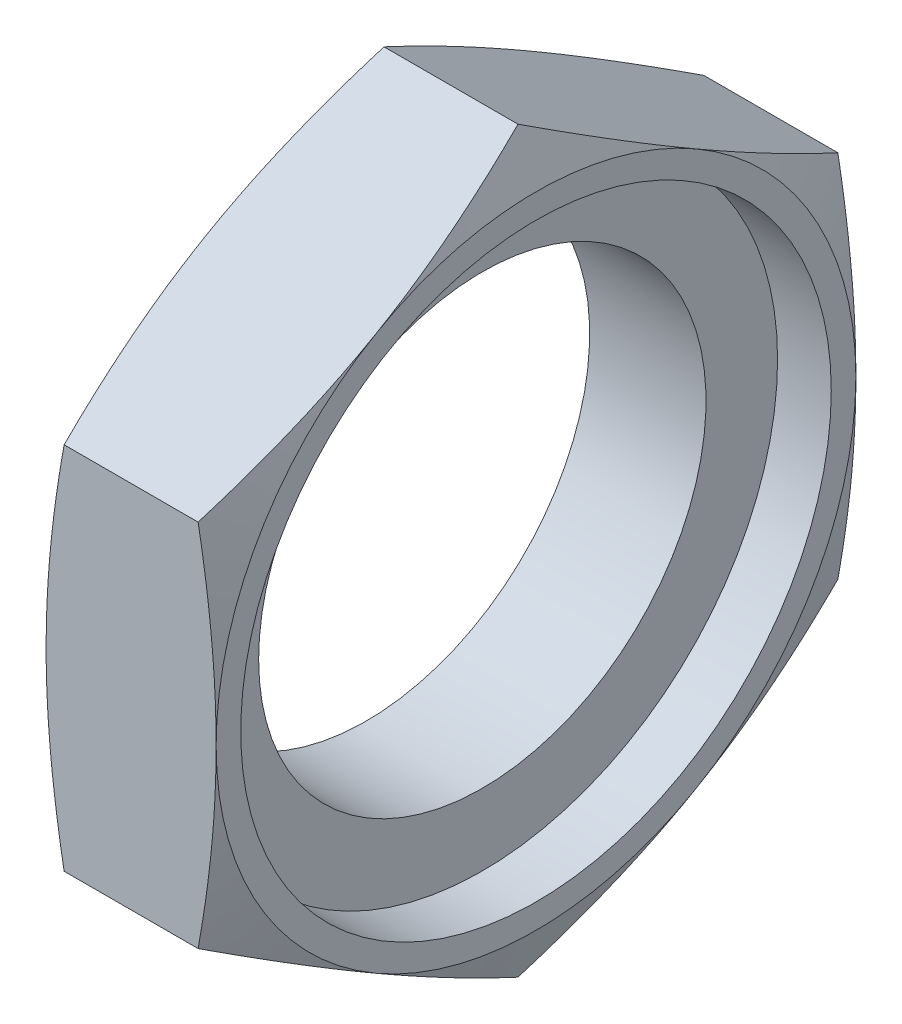
from build123d import *

# Parameters (mm, degrees)
ESBO_O1_R                = 10
RESSALTO_EXTRUS_O1_DEPTH = 7.6
FURO1_D                  = 26.4
FURO1_DEPTH              = 2.4
ESBO_O7_OUTSIDE_W        = 110.904
ESBO_O7_OUTSIDE_H        = 115.328
ESBO_O7_OUTSIDE_R        = 14.3
CORTE_EXTRUS_O1_DEPTH    = 13
CORTE_EXTRUS_O1_DRAFT    = -70
ESBO_O8_OUTSIDE_W        = 110.904
ESBO_O8_OUTSIDE_H        = 115.328
ESBO_O8_OUTSIDE_R        = 14.3
CORTE_EXTRUS_O2_DEPTH    = 13
CORTE_EXTRUS_O2_DRAFT    = -70


with BuildPart() as part:
    # Esboço1 → Ressalto-extrusão1 (new body)
    with BuildSketch(Plane(origin=(0, 0, 0), x_dir=(0, 0, -1), z_dir=(1, 0, 0))):
        Polygon((14.3, 8.256108849), (14.3, -8.256108849), (0, -16.512217699), (-14.3, -8.256108849), (-14.3, 8.256108849), (0, 16.512217699), align=None)
        with Locations(Location((0, 0, 0), (0, 0, 180))):
            Circle(ESBO_O1_R, mode=Mode.SUBTRACT)
    extrude(amount=RESSALTO_EXTRUS_O1_DEPTH)

    # Furo1
    with Locations(Plane(origin=(7.6, 0, 0), x_dir=(0, 0, -1), z_dir=(1, 0, 0))):
        with Locations((0, 0)):
            Hole(FURO1_D / 2, depth=FURO1_DEPTH)


with BuildPart() as corte_extrus_o1_tool:
    # Esboço7 outside → Corte-extrusão1 (with draft: the straight prism first)
    with BuildSketch(Plane(origin=(7.6, 0, 0), x_dir=(0, 0, -1), z_dir=(1, 0, 0))):
        Rectangle(ESBO_O7_OUTSIDE_W, ESBO_O7_OUTSIDE_H)
        Circle(ESBO_O7_OUTSIDE_R, mode=Mode.SUBTRACT)
    extrude(amount=-CORTE_EXTRUS_O1_DEPTH)
    # Corte-extrusão1: the draft: its side faces are tilted about the plane it starts from
    corte_extrus_o1_sides = [corte_extrus_o1_tool.faces().sort_by_distance(p)[0] for p in [
        (1.1, -57.664, 0),
        (1.1, 0, -55.452),
        (1.1, 57.664, 0),
        (1.1, 0, 55.452),
        (1.1, 0, 14.3),
    ]]
    draft(corte_extrus_o1_sides, Plane(origin=(7.6, 0, 0), x_dir=(0, 0, -1), z_dir=(1, 0, 0)), CORTE_EXTRUS_O1_DRAFT)


with BuildPart() as part_1:
    add(part.part)

    # Corte-extrusão1: cut by corte_extrus_o1_tool
    add(corte_extrus_o1_tool.part, mode=Mode.SUBTRACT)


with BuildPart() as corte_extrus_o2_tool:
    # Esboço8 outside → Corte-extrusão2 (with draft: the straight prism first)
    with BuildSketch(Plane.ZY):
        Rectangle(ESBO_O8_OUTSIDE_W, ESBO_O8_OUTSIDE_H)
        Circle(ESBO_O8_OUTSIDE_R, mode=Mode.SUBTRACT)
    extrude(amount=-CORTE_EXTRUS_O2_DEPTH)
    # Corte-extrusão2: the draft: its side faces are tilted about the plane it starts from
    corte_extrus_o2_sides = [corte_extrus_o2_tool.faces().sort_by_distance(p)[0] for p in [
        (6.5, -57.664, 0),
        (6.5, 0, 55.452),
        (6.5, 57.664, 0),
        (6.5, 0, -55.452),
        (6.5, 0, -14.3),
    ]]
    draft(corte_extrus_o2_sides, Plane.ZY, CORTE_EXTRUS_O2_DRAFT)


with BuildPart() as part_2:
    add(part_1.part)

    # Corte-extrusão2: cut by corte_extrus_o2_tool
    add(corte_extrus_o2_tool.part, mode=Mode.SUBTRACT)


solid = part_2.part
